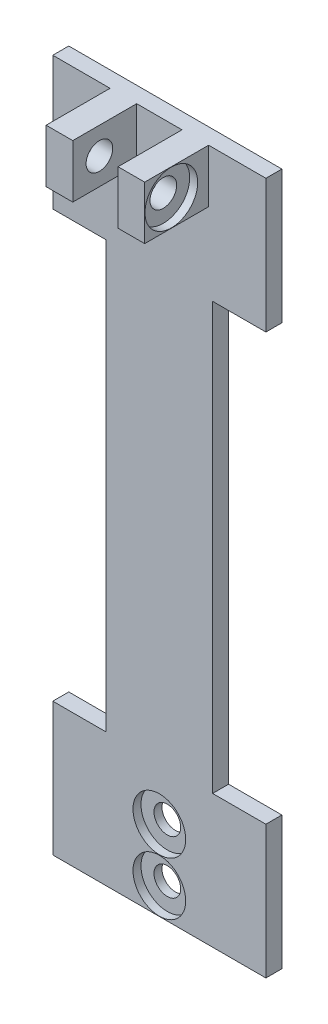
from build123d import *

# Parameters (mm, degrees)
SKETCH1_R             = 4.95
SKETCH1_W             = 5
SKETCH1_H             = 10
SKETCH1_W_2           = 8.5
BODY_DEPTH            = 3
SKETCH1_3_R           = 4.95
SKETCH1_3_R_2         = 2.5
MOUNT_INSETS_DEPTH    = 1.5
SKETCH1_5_W           = 5
SKETCH1_5_H           = 10
HINGE_DEPTH           = 15
SKETCH2_R             = 4.95
SKETCH2_R_2           = 2.5
HINGE_INSET_DEPTH     = 1.5
HINGE_START           = -17
SKETCH2_2_R           = 4.95
SKETCH2_2_R_2         = 2.5
HINGE_INSET2_DEPTH    = 1.5
SKETCH2_3_R           = 2.5
HINGE_SCREWHOLE_DEPTH = 120.897733068


with BuildPart() as part:
    # Sketch1 → Body (new body)
    # profile 1 of 4: a face of its own
    with BuildSketch(Plane.XY):
        Polygon((-23.27588231, 115.303529412), (-34.02588231, 115.303529412), (-34.02588231, 90.303529412), (-24.02588231, 90.303529412), (-24.02588231, 10.303529412), (-34.02588231, 10.303529412), (-34.02588231, -14.696470588), (5.97411769, -14.696470588), (5.97411769, 10.303529412), (-4.02588231, 10.303529412), (-4.02588231, 90.303529412), (5.97411769, 90.303529412), (5.97411769, 115.303529412), (-4.77588231, 115.303529412), (-4.77588231, 105.303529412), (-9.77588231, 105.303529412), (-18.27588231, 105.303529412), (-23.27588231, 105.303529412), align=None)
        with Locations((-14.02588231, -9.696470588)):
            Circle(SKETCH1_R, mode=Mode.SUBTRACT)
        with Locations((-14.02588231, 0.303529412)):
            Circle(SKETCH1_R, mode=Mode.SUBTRACT)
    # profile 2 of 4: a face of its own
    with BuildSketch(Plane.XY):
        with Locations((-20.77588231, 110.303529412)):
            Rectangle(SKETCH1_W, SKETCH1_H)
    # profile 3 of 4: a face of its own
    with BuildSketch(Plane.XY):
        with Locations((-14.02588231, 110.303529412)):
            Rectangle(SKETCH1_W_2, SKETCH1_H)
    # profile 4 of 4: a face of its own
    with BuildSketch(Plane.XY):
        with Locations((-7.27588231, 110.303529412)):
            Rectangle(SKETCH1_W, SKETCH1_H)
    extrude(amount=BODY_DEPTH)

    # Sketch1<3> → Mount Insets (add)
    # profile 1 of 2: a face of its own
    with BuildSketch(Plane.XY):
        with Locations((-14.02588231, 0.303529412)):
            Circle(SKETCH1_3_R)
        with Locations((-14.02588231, 0.303529412)):
            Circle(SKETCH1_3_R_2, mode=Mode.SUBTRACT)
    # profile 2 of 2: a face of its own
    with BuildSketch(Plane.XY):
        with Locations((-14.02588231, -9.696470588)):
            Circle(SKETCH1_3_R)
        with Locations((-14.02588231, -9.696470588)):
            Circle(SKETCH1_3_R_2, mode=Mode.SUBTRACT)
    extrude(amount=MOUNT_INSETS_DEPTH)

    # Sketch1<5> → Hinge (add)
    with BuildSketch(Plane.XY):
        with Locations((-7.27588231, 110.303529412)):
            Rectangle(SKETCH1_5_W, SKETCH1_5_H)
        with Locations((-20.77588231, 110.303529412)):
            Rectangle(SKETCH1_5_W, SKETCH1_5_H)
    extrude(amount=HINGE_DEPTH)

    # Sketch2 → Hinge Inset (cut)
    with BuildSketch(Plane(origin=(-4.77588231, 0, 0), x_dir=(0, 0, -1), z_dir=(1, 0, 0))):
        with Locations((-10, 110.303529412)):
            Circle(SKETCH2_R)
        with Locations((-10, 110.303529412)):
            Circle(SKETCH2_R_2, mode=Mode.SUBTRACT)
    extrude(amount=-HINGE_INSET_DEPTH, mode=Mode.SUBTRACT)

    # Sketch2<2> → Hinge Inset2 (cut)
    with BuildSketch(Plane(origin=(-4.77588231, 0, 0), x_dir=(0, 0, -1), z_dir=(1, 0, 0)).offset(HINGE_START)):
        with Locations((-10, 110.303529412)):
            Circle(SKETCH2_2_R)
        with Locations((-10, 110.303529412)):
            Circle(SKETCH2_2_R_2, mode=Mode.SUBTRACT)
    extrude(amount=-HINGE_INSET2_DEPTH, mode=Mode.SUBTRACT)

    # Sketch2<3> → Hinge Screwhole (cut, through all)
    with BuildSketch(Plane(origin=(-4.77588231, 0, 0), x_dir=(0, 0, -1), z_dir=(1, 0, 0))):
        with Locations(Location((-10, 110.303529412, 0), (0, 0, 270))):
            Circle(SKETCH2_3_R)
    extrude(amount=-HINGE_SCREWHOLE_DEPTH, mode=Mode.SUBTRACT)


solid = part.part
